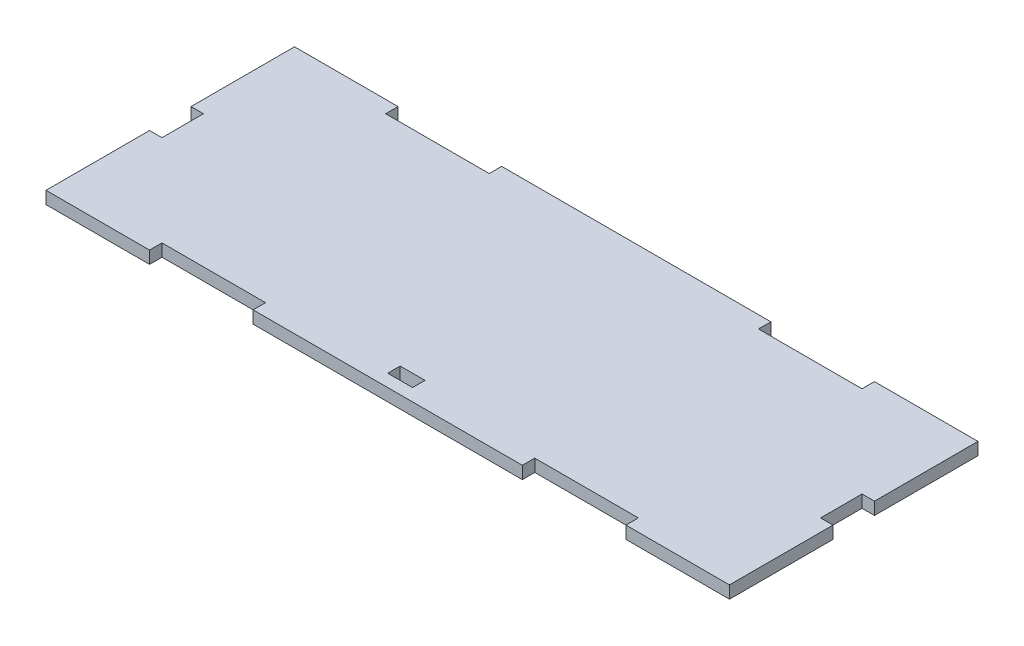
from build123d import *

# Parameters (mm, degrees)
SKETCH1_W           = 6
SKETCH1_H           = 3
BOSS_EXTRUDE2_DEPTH = 3


with BuildPart() as part:
    # Sketch1 → Boss-Extrude2 (new body)
    with BuildSketch(Plane(origin=(0, 0, 0), x_dir=(1, 0, 0), z_dir=(0, 1, 0))):
        Polygon((-57.5, 30), (-82.5, 30), (-82.5, 5), (-79.5, 5), (-79.5, -5), (-82.5, -5), (-82.5, -30), (-57.5, -30), (-57.5, -27), (-32.5, -27), (-32.5, -30), (32.5, -30), (32.5, -27), (57.5, -27), (57.5, -30), (82.5, -30), (82.5, -5), (79.5, -5), (79.5, 5), (82.5, 5), (82.5, 30), (57.5, 30), (57.5, 27), (32.5, 27), (32.5, 30), (-32.5, 30), (-32.5, 27), (-57.5, 27), align=None)
        with Locations((0, -25.5)):
            Rectangle(SKETCH1_W, SKETCH1_H, mode=Mode.SUBTRACT)
    extrude(amount=BOSS_EXTRUDE2_DEPTH)


solid = part.part
